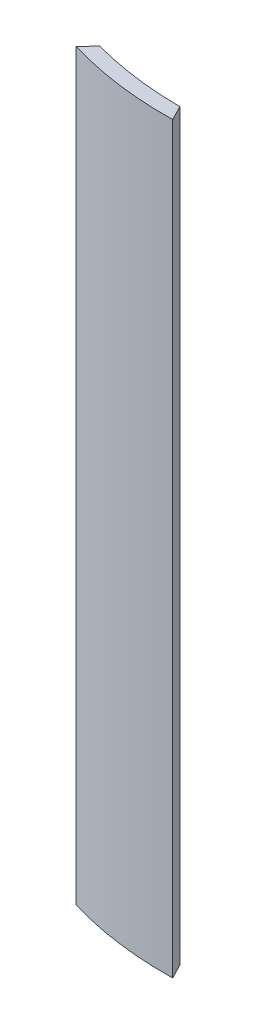
from build123d import *

# Parameters (mm, degrees)
BOSS_EXTRUDE1_DEPTH = 10
SCALE1_SCALE        = 5


with BuildPart() as part:
    # Sketch1 → Boss-Extrude1 (new body)
    with BuildSketch(Plane(origin=(0, 0, 0), x_dir=(1, 0, 0), z_dir=(0, 1, 0))):
        with BuildLine():
            Line((-1.245040654, -4.583925585), (-1.39635158, -4.748968547))
            ThreePointArc((-1.39635158, -4.748968547), (-0.654477562, -4.906542481), (0.102760596, -4.948933245))
            Line((0.102760596, -4.948933245), (0, -4.75))
            ThreePointArc((0, -4.75), (-0.628034024, -4.708298341), (-1.245040654, -4.583925585))
        make_face()
    extrude(amount=BOSS_EXTRUDE1_DEPTH)


with BuildPart() as part_1:
    # Scale1: scaled about (-0.639460957, 5, 4.793964734)
    add(part.part.scale(SCALE1_SCALE).moved(Location((2.557843828, -20, -19.175858936))))


solid = part_1.part
